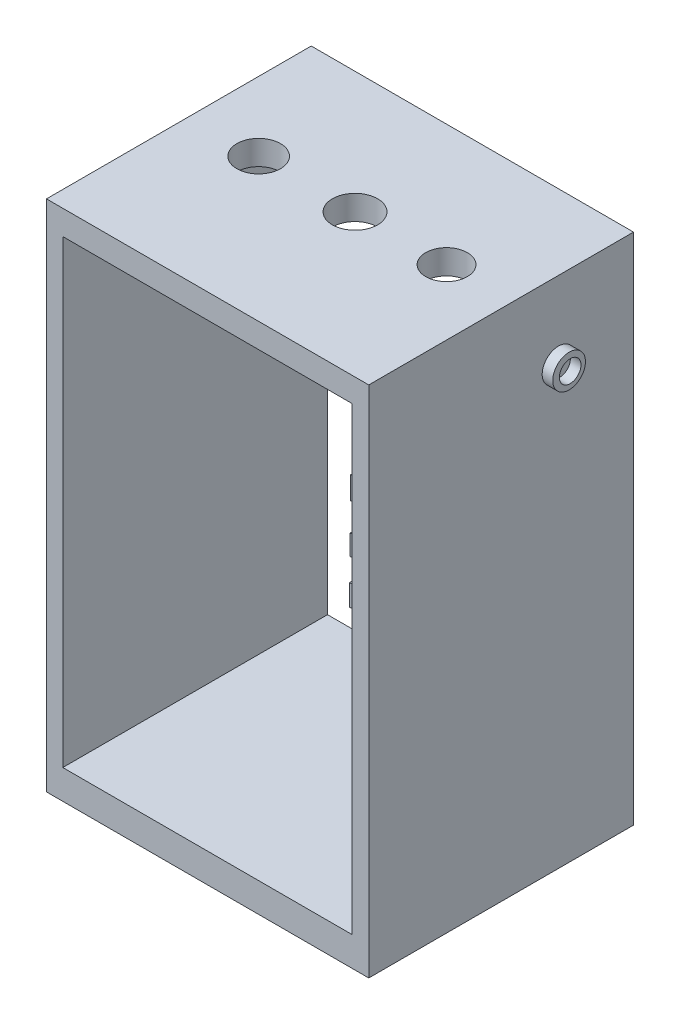
from build123d import *

# Parameters (mm, degrees)
SKETCH1_W           = 60.861702088
SKETCH1_H           = 96.997143498
BOSS_EXTRUDE1_DEPTH = 50
SKETCH2_W           = 54.597089422
SKETCH2_H           = 86.84373193
CUT_EXTRUDE1_DEPTH  = 50
SKETCH3_R           = 4.118180668
SKETCH3_R_2         = 4.272844434
SKETCH3_R_3         = 3.932739474
CUT_EXTRUDE2_DEPTH  = 6
SKETCH4_R           = 3.08771087
BOSS_EXTRUDE2_DEPTH = 2
SKETCH5_R           = 2.038212953
CUT_EXTRUDE3_DEPTH  = 2
SKETCH6_R           = 3.908744467
SKETCH6_R_2         = 2.535125685
BOSS_EXTRUDE3_DEPTH = 2
SKETCH7_R           = 2.219432532
CUT_EXTRUDE4_DEPTH  = 2
SKETCH8_W           = 47.395397398
SKETCH8_H           = 4.29160036
SKETCH8_W_2         = 46.234961005
SKETCH8_H_2         = 3.842331126
SKETCH8_W_3         = 46.458453643
SKETCH8_H_3         = 4.013838195
SKETCH8_W_4         = 44.816524007
SKETCH8_H_4         = 3.759016324
SKETCH8_W_5         = 44.332896866
SKETCH8_H_5         = 3.544111845
SKETCH8_W_6         = 43.835439371
SKETCH8_H_6         = 4.852900567
SKETCH8_W_7         = 44.232019009
SKETCH8_H_7         = 3.586032373
SKETCH8_W_8         = 44.502323157
SKETCH8_H_8         = 5.537324529
BOSS_EXTRUDE4_DEPTH = 2
SKETCH9_W           = 44.730161392
SKETCH9_H           = 4.206770637
SKETCH9_W_2         = 43.731962655
SKETCH9_H_2         = 4.51977805
BOSS_EXTRUDE5_DEPTH = 2


with BuildPart() as part:
    # Sketch1 → Boss-Extrude1 (new body)
    with BuildSketch(Plane.XY):
        Rectangle(SKETCH1_W, SKETCH1_H)
    extrude(amount=BOSS_EXTRUDE1_DEPTH)

    # Sketch2 → Cut-Extrude1 (cut)
    with BuildSketch(Plane.XY.offset(50)):
        with Locations((-0.054476232, 0.453696841)):
            Rectangle(SKETCH2_W, SKETCH2_H)
    extrude(amount=-CUT_EXTRUDE1_DEPTH, mode=Mode.SUBTRACT)

    # Sketch3 → Cut-Extrude2 (cut)
    with BuildSketch(Plane(origin=(0, 48.498571749, 0), x_dir=(1, 0, 0), z_dir=(0, 1, 0))):
        with Locations(Location((-17.379612091, -22.981855157, 0), (0, 0, 270))):
            Circle(SKETCH3_R)
        with Locations(Location((0.816264726, -22.981855157, 0), (0, 0, 270))):
            Circle(SKETCH3_R_2)
        with Locations(Location((18.098885302, -22.981855157, 0), (0, 0, 270))):
            Circle(SKETCH3_R_3)
    extrude(amount=-CUT_EXTRUDE2_DEPTH, mode=Mode.SUBTRACT)

    # Sketch4 → Boss-Extrude2 (add)
    with BuildSketch(Plane(origin=(30.430851044, 0, 0), x_dir=(0, 0, -1), z_dir=(1, 0, 0))):
        with Locations(Location((-14.163441472, 33.849346779, 0), (0, 0, 180))):
            Circle(SKETCH4_R)
    extrude(amount=BOSS_EXTRUDE2_DEPTH)

    # Sketch5 → Cut-Extrude3 (cut)
    with BuildSketch(Plane(origin=(32.430851044, 0, 0), x_dir=(0, 0, -1), z_dir=(1, 0, 0))):
        with Locations((-13.96185256, 33.734367255)):
            Circle(SKETCH5_R)
    extrude(amount=-CUT_EXTRUDE3_DEPTH, mode=Mode.SUBTRACT)

    # Sketch6 → Boss-Extrude3 (add)
    with BuildSketch(Plane.ZY.offset(30.430851044)):
        with Locations(Location((13.179644946, 35.995992558, 0), (0, 0, 180))):
            Circle(SKETCH6_R)
        with Locations((13.179644946, 35.995992558)):
            Circle(SKETCH6_R_2, mode=Mode.SUBTRACT)
    extrude(amount=BOSS_EXTRUDE3_DEPTH)

    # Sketch7 → Cut-Extrude4 (cut)
    with BuildSketch(Plane.ZY.offset(30.430851044)):
        with Locations((13.179644946, 35.995992558)):
            Circle(SKETCH7_R)
    extrude(amount=-CUT_EXTRUDE4_DEPTH, mode=Mode.SUBTRACT)

    # Sketch8 → Boss-Extrude4 (add)
    with BuildSketch(Plane.ZY.offset(-27.244068479)):
        with Locations((24.521897503, 28.206728859)):
            Rectangle(SKETCH8_W, SKETCH8_H)
        with Locations((25.229689805, 18.94599963)):
            Rectangle(SKETCH8_W_2, SKETCH8_H_2)
        with Locations((25.229689805, 10.788271288)):
            Rectangle(SKETCH8_W_3, SKETCH8_H_3)
        with Locations((23.657759327, 2.882970932)):
            Rectangle(SKETCH8_W_4, SKETCH8_H_4)
        with Locations((23.899572897, -5.013591611)):
            Rectangle(SKETCH8_W_5, SKETCH8_H_5)
        with Locations((24.148301645, -13.789703554)):
            Rectangle(SKETCH8_W_6, SKETCH8_H_6)
        with Locations((23.950011826, -21.862272303)):
            Rectangle(SKETCH8_W_7, SKETCH8_H_7)
        with Locations((24.1320976, -31.257152078)):
            Rectangle(SKETCH8_W_8, SKETCH8_H_8)
    extrude(amount=BOSS_EXTRUDE4_DEPTH)

    # Sketch9 → Boss-Extrude5 (add)
    with BuildSketch(Plane.ZY.offset(-27.244068479)):
        with Locations((24.880043499, 35.759572617)):
            Rectangle(SKETCH9_W, SKETCH9_H)
        with Locations((23.711117662, -38.822738944)):
            Rectangle(SKETCH9_W_2, SKETCH9_H_2)
    extrude(amount=BOSS_EXTRUDE5_DEPTH)


solid = part.part
